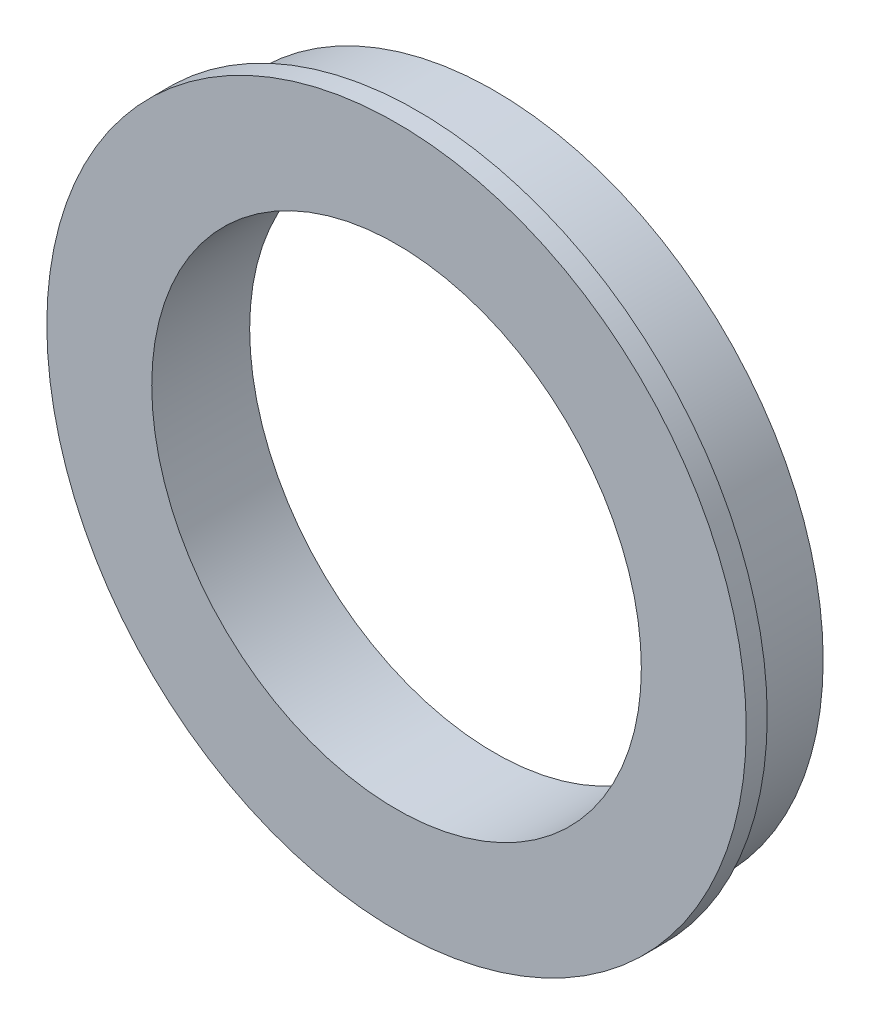
from build123d import *

# Parameters (mm, degrees)
SKETCH_1_R      = 23.5
SKETCH_1_R_2    = 17.5
EXTRUDE_1_DEPTH = 5.5
SKETCH_2_R      = 25
SKETCH_2_R_2    = 17.5
EXTRUDE_2_DEPTH = 1.5


with BuildPart() as part:
    # 草图1 → 凸台-拉伸1 (new body)
    with BuildSketch(Plane.XY):
        Circle(SKETCH_1_R)
        Circle(SKETCH_1_R_2, mode=Mode.SUBTRACT)
    extrude(amount=EXTRUDE_1_DEPTH)

    # 草图2 → 凸台-拉伸2 (add)
    with BuildSketch(Plane.XY.offset(5.5)):
        Circle(SKETCH_2_R)
        Circle(SKETCH_2_R_2, mode=Mode.SUBTRACT)
    extrude(amount=EXTRUDE_2_DEPTH)


solid = part.part
